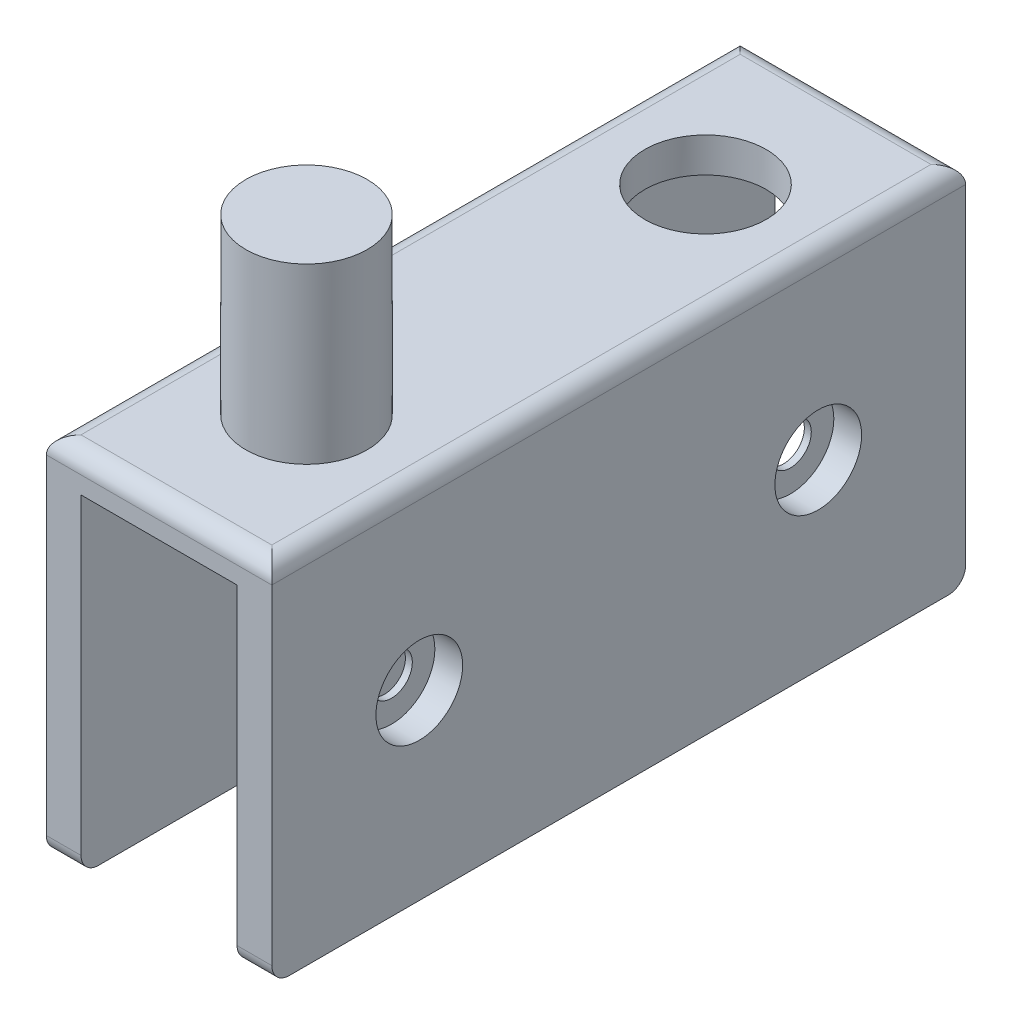
from build123d import *

# Parameters (mm, degrees)
BOSS_EXTRUDE1_DEPTH                              = 20
CBORE_FOR_M2_PAN_HEAD_MACHINE_SCREW1_D           = 2.4
CBORE_FOR_M2_PAN_HEAD_MACHINE_SCREW1_DEPTH       = 2
CBORE_FOR_M2_PAN_HEAD_MACHINE_SCREW1_CBORE_D     = 5
CBORE_FOR_M2_PAN_HEAD_MACHINE_SCREW1_CBORE_DEPTH = 1.6
FILLET1_R                                        = 1
SKETCH4_4_R                                      = 3.5
BOSS_EXTRUDE3_DEPTH                              = 10
SKETCH4_5_R                                      = 3.5
CUT_EXTRUDE2_DEPTH                               = 10


with BuildPart() as part:
    # Sketch1 → Boss-Extrude1 (new, symmetric)
    with BuildSketch(Plane.XY):
        Polygon((-6.5, 21), (-6.5, 0), (-4.5, 0), (-4.5, 19), (0, 19), (0, 21), align=None)
        Polygon((0, 19), (4.5, 19), (4.5, 0), (6.5, 0), (6.5, 21), (0, 21), align=None)
    extrude(amount=BOSS_EXTRUDE1_DEPTH, both=True)

    # CBORE for M2 Pan Head Machine Screw1
    with Locations(Plane(origin=(6.5, 0, 0), x_dir=(0, 0, -1), z_dir=(1, 0, 0))):
        with Locations((-11.5, 10.5), (11.5, 10.5)):
            CounterBoreHole(CBORE_FOR_M2_PAN_HEAD_MACHINE_SCREW1_D / 2, CBORE_FOR_M2_PAN_HEAD_MACHINE_SCREW1_CBORE_D / 2, CBORE_FOR_M2_PAN_HEAD_MACHINE_SCREW1_CBORE_DEPTH, depth=CBORE_FOR_M2_PAN_HEAD_MACHINE_SCREW1_DEPTH)

    # Fillet1
    fillet1_edges = [part.edges().sort_by_distance(p)[0] for p in [
        (-5.5, 0, 20),
        (0, 21, -20),
        (5.5, 0, -20),
        (-5.5, 0, -20),
        (-6.5, 21, 0),
        (6.5, 21, 0),
        (5.5, 0, 20),
        (0, 21, 20),
    ]]
    fillet(fillet1_edges, radius=FILLET1_R)

    # Sketch4<4> → Boss-Extrude3 (add)
    with BuildSketch(Plane(origin=(0, 21, 0), x_dir=(1, 0, 0), z_dir=(0, 1, 0))):
        with Locations(Location((0, -11.5, 0), (0, 0, 90))):
            Circle(SKETCH4_4_R)
    extrude(amount=BOSS_EXTRUDE3_DEPTH)

    # Sketch4<5> → Cut-Extrude2 (cut)
    with BuildSketch(Plane(origin=(0, 21, 0), x_dir=(1, 0, 0), z_dir=(0, 1, 0))):
        with Locations(Location((0, 11.5, 0), (0, 0, 270))):
            Circle(SKETCH4_5_R)
    extrude(amount=-CUT_EXTRUDE2_DEPTH, mode=Mode.SUBTRACT)


solid = part.part
